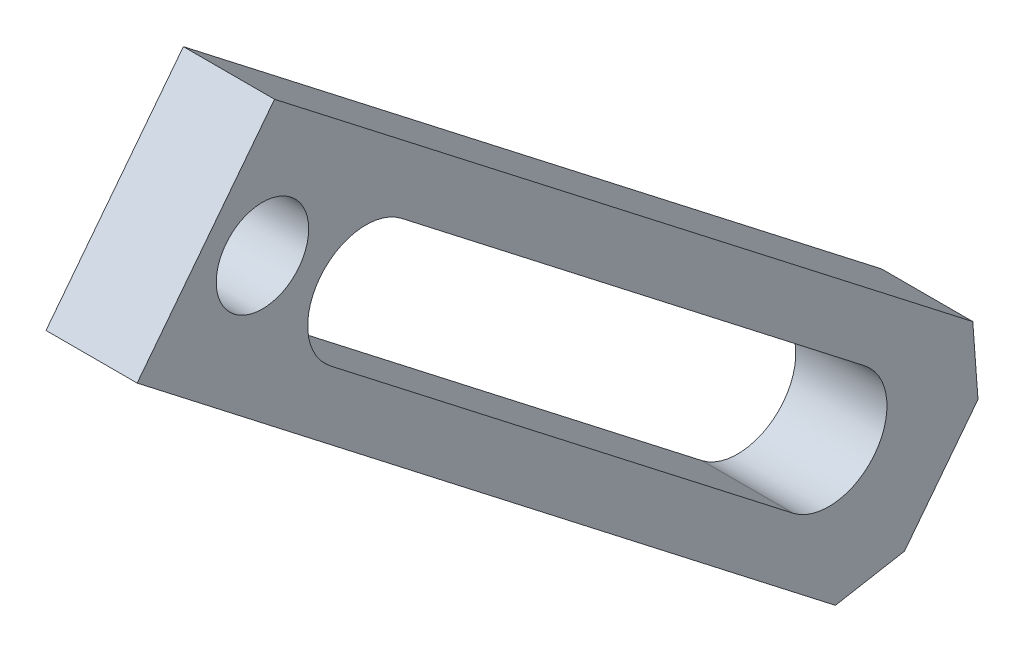
from build123d import *

# Parameters (mm, degrees)
SKETCH1_R           = 8.100025456
BOSS_EXTRUDE1_DEPTH = 15.972282


with BuildPart() as part:
    # Sketch1 → Boss-Extrude1 (new body)
    with BuildSketch(Plane(origin=(0, 0, 0), x_dir=(0, 0, -1), z_dir=(1, 0, 0))):
        Polygon((253.669292, 98.434652), (277.738586, 129.464308), (400.07286, 34.572448), (400.988022, 22.300438), (394.552932, 14.004036), (388.117588, 5.707888), (376.003566, 3.542538), align=None)
        with Locations((275.620988, 106.805984)):
            Circle(SKETCH1_R, mode=Mode.SUBTRACT)
        with BuildLine():
            Line((287.497774, 84.130896), (368.581432, 21.235924))
            ThreePointArc((368.581432, 21.235924), (382.898018562, 23.044528237), (381.089408, 37.361114))
            Line((381.089408, 37.361114), (300.00575, 100.255832))
            ThreePointArc((300.00575, 100.255832), (285.689367711, 98.447294823), (287.497774, 84.130896))
        make_face(mode=Mode.SUBTRACT)
    extrude(amount=-BOSS_EXTRUDE1_DEPTH)


solid = part.part
